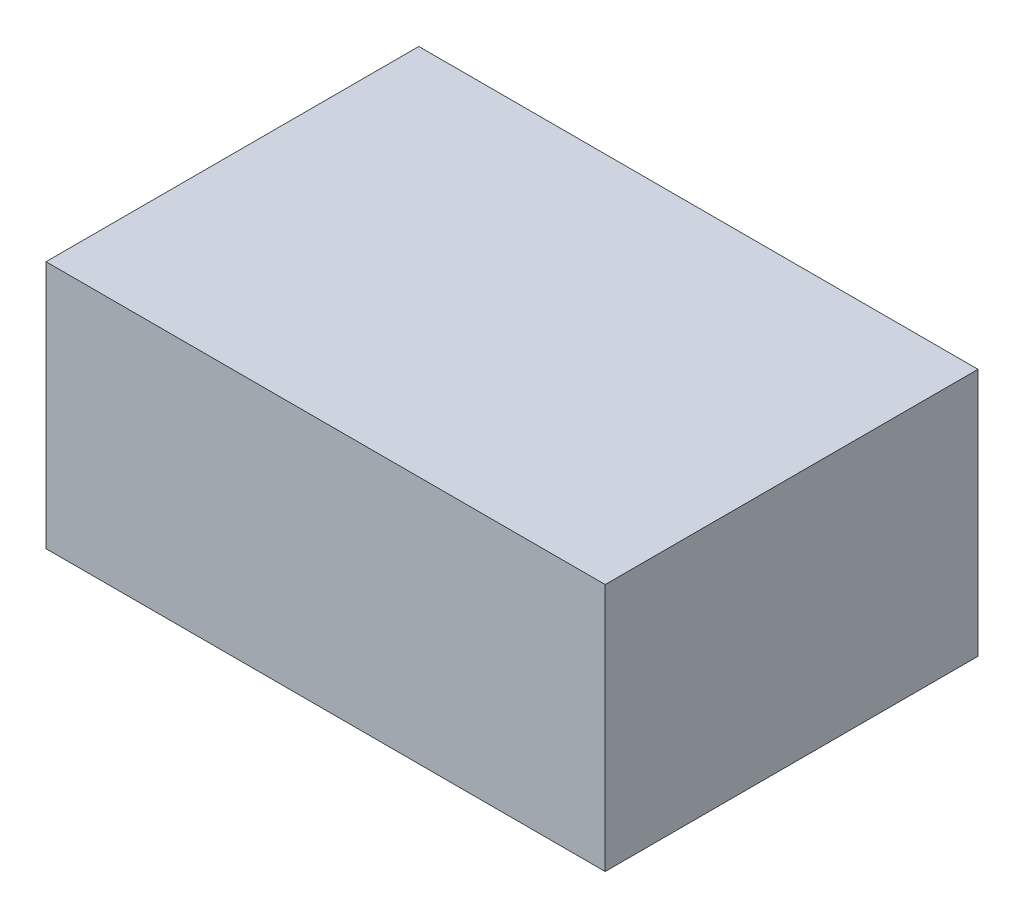
from build123d import *

# Parameters (mm, degrees)
SKETCH2_W           = 85.725
SKETCH2_H           = 57.15
BOSS_EXTRUDE1_DEPTH = 38.1


with BuildPart() as part:
    # Sketch2 → Boss-Extrude1 (new body)
    with BuildSketch(Plane(origin=(0, 0, 0), x_dir=(1, 0, 0), z_dir=(0, 1, 0))):
        with Locations((20.723368376, 5.201953693)):
            Rectangle(SKETCH2_W, SKETCH2_H)
    extrude(amount=BOSS_EXTRUDE1_DEPTH)


solid = part.part
